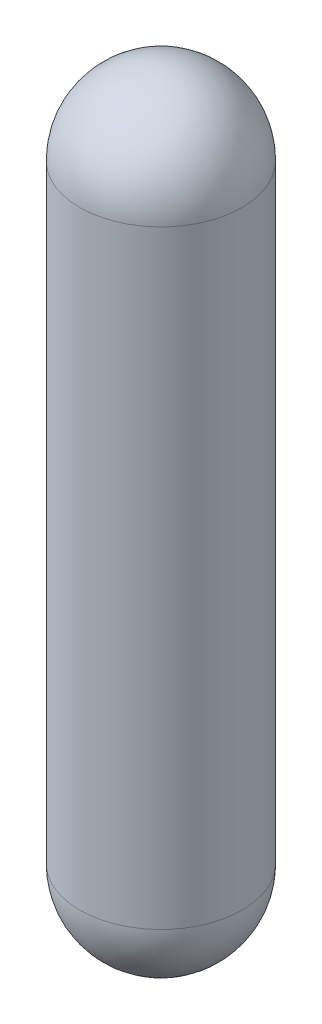
from build123d import *

# Parameters (mm, degrees)
SKETCH1_R           = 10
BOSS_EXTRUDE1_DEPTH = 75
DOME2_FACE_RADIUS   = 10
DOME2_HEIGHT        = 10
DOME3_FACE_RADIUS   = 10
DOME3_HEIGHT        = 10


with BuildPart() as part:
    # Sketch1 → Boss-Extrude1 (new body)
    with BuildSketch(Plane(origin=(0, 0, 0), x_dir=(1, 0, 0), z_dir=(0, 1, 0))):
        with Locations(Location((0, 0, 0), (0, 0, 270))):
            Circle(SKETCH1_R)
    extrude(amount=BOSS_EXTRUDE1_DEPTH)

    # Dome2: a dome of height H over a round flat face of radius A is a cap of a sphere of radius (A * A + H * H) / (2 * H)
    dome2_r = (DOME2_FACE_RADIUS * DOME2_FACE_RADIUS + DOME2_HEIGHT * DOME2_HEIGHT) / (2 * DOME2_HEIGHT)
    dome2_base = Plane((0, 75, 0), z_dir=(0, 1, 0))
    with Locations(dome2_base.offset(DOME2_HEIGHT - dome2_r)):
        dome2_ball = Sphere(dome2_r, mode=Mode.PRIVATE)
    add(split(dome2_ball, bisect_by=dome2_base, keep=Keep.TOP, mode=Mode.PRIVATE))

    # Dome3: a dome of height H over a round flat face of radius A is a cap of a sphere of radius (A * A + H * H) / (2 * H)
    dome3_r = (DOME3_FACE_RADIUS * DOME3_FACE_RADIUS + DOME3_HEIGHT * DOME3_HEIGHT) / (2 * DOME3_HEIGHT)
    dome3_base = Plane((0, 0, 0), z_dir=(0, -1, 0))
    with Locations(dome3_base.offset(DOME3_HEIGHT - dome3_r)):
        dome3_ball = Sphere(dome3_r, mode=Mode.PRIVATE)
    add(split(dome3_ball, bisect_by=dome3_base, keep=Keep.TOP, mode=Mode.PRIVATE))


solid = part.part
